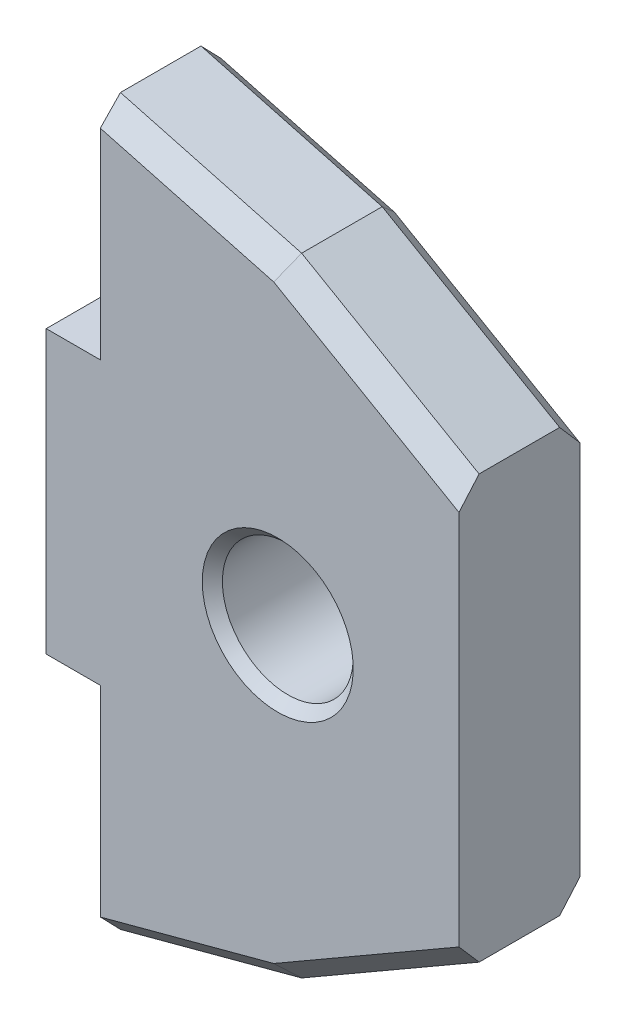
from build123d import *

# Parameters (mm, degrees)
EXTRUDE_1_DEPTH     = 6
SKETCH_2_R          = 6.5
CUT_EXTRUDE_1_DEPTH = 56.865910894
CHAMFER_1_SIZE      = 1
CHAMFER_2_SIZE      = 2


with BuildPart() as part:
    # 草图1 → 凸台-拉伸1 (new, symmetric)
    with BuildSketch(Plane.XY):
        Polygon((0, -14), (0, 14), (5.373066959, 14), (5.373066959, 36), (23.373066959, 31.176914536), (41, 21), (41, -21), (23.373066959, -31.176914536), (5.373066959, -36), (5.373066959, -14), align=None)
    extrude(amount=EXTRUDE_1_DEPTH, both=True)

    # 草图2 → 切除-拉伸1 (cut, through all)
    with BuildSketch(Plane.XY.offset(6)):
        with Locations((23, 0)):
            Circle(SKETCH_2_R)
    extrude(amount=-CUT_EXTRUDE_1_DEPTH, mode=Mode.SUBTRACT)

    # 倒角1
    chamfer_1_edges = [part.edges().sort_by_distance(p)[0] for p in [
        (16.5, 0, -6),
        (16.5, 0, 6),
    ]]
    chamfer(chamfer_1_edges, length=CHAMFER_1_SIZE)

    # 倒角2
    chamfer_2_edges = [part.edges().sort_by_distance(p)[0] for p in [
        (14.373066959, -33.588457268, -6),
        (14.373066959, 33.588457268, -6),
        (32.186533479, 26.088457268, 6),
        (32.186533479, 26.088457268, -6),
        (32.186533479, -26.088457268, -6),
        (14.373066959, 33.588457268, 6),
        (14.373066959, -33.588457268, 6),
        (32.186533479, -26.088457268, 6),
    ]]
    chamfer(chamfer_2_edges, length=CHAMFER_2_SIZE)


solid = part.part
